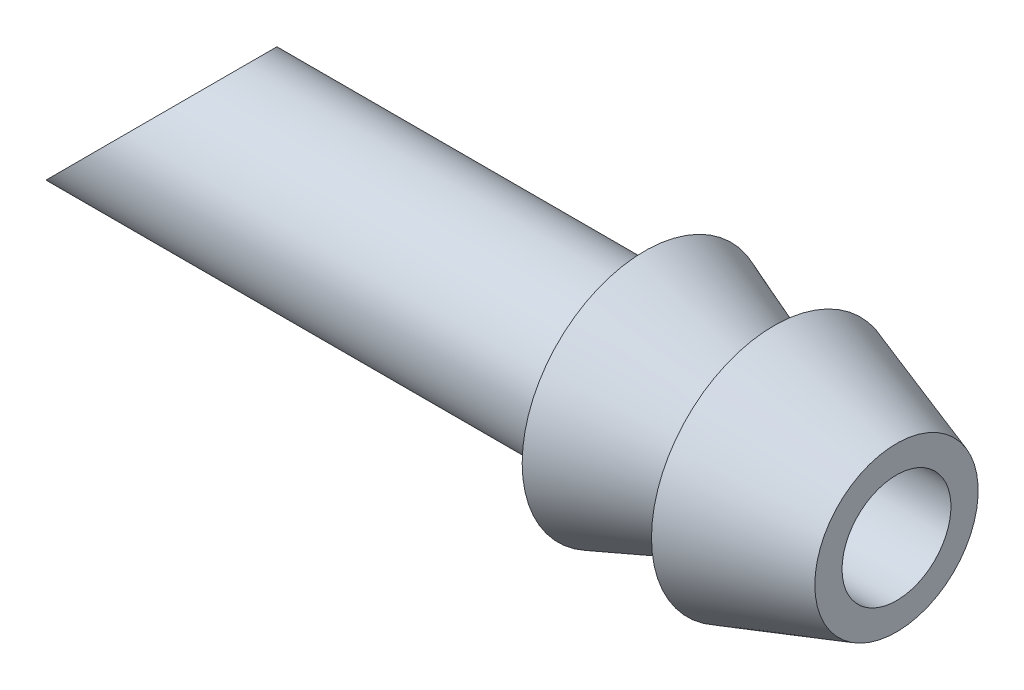
from build123d import *

# Parameters (mm, degrees)
CUT_EXTRUDE1_DEPTH      = 10
CUT_EXTRUDE1_DEPTH_BACK = 10


with BuildPart() as part:
    # Sketch1 → Revolve1 (revolve)
    with BuildSketch(Plane.XY):
        Polygon((22.151518872, 3), (17.651518872, 4.5), (17.651518872, 3), (16.901518872, 3), (12.901518872, 4.5), (12.901518872, 3), (-7.848481128, 3), (-7.848481128, 2), (22.151518872, 2), align=None)
    revolve(axis=Axis((0, 0, 0), (1, 0, 0)))

    # Sketch2 → Cut-Extrude1 (cut, two sides: drawn at the far end of the back side and taken through both)
    with BuildSketch(Plane.XY.offset(-CUT_EXTRUDE1_DEPTH_BACK)):
        Polygon((-7.848481128, -3), (-1.848481128, 3), (-7.848481128, 3), align=None)
    extrude(amount=CUT_EXTRUDE1_DEPTH + CUT_EXTRUDE1_DEPTH_BACK, mode=Mode.SUBTRACT)


solid = part.part
